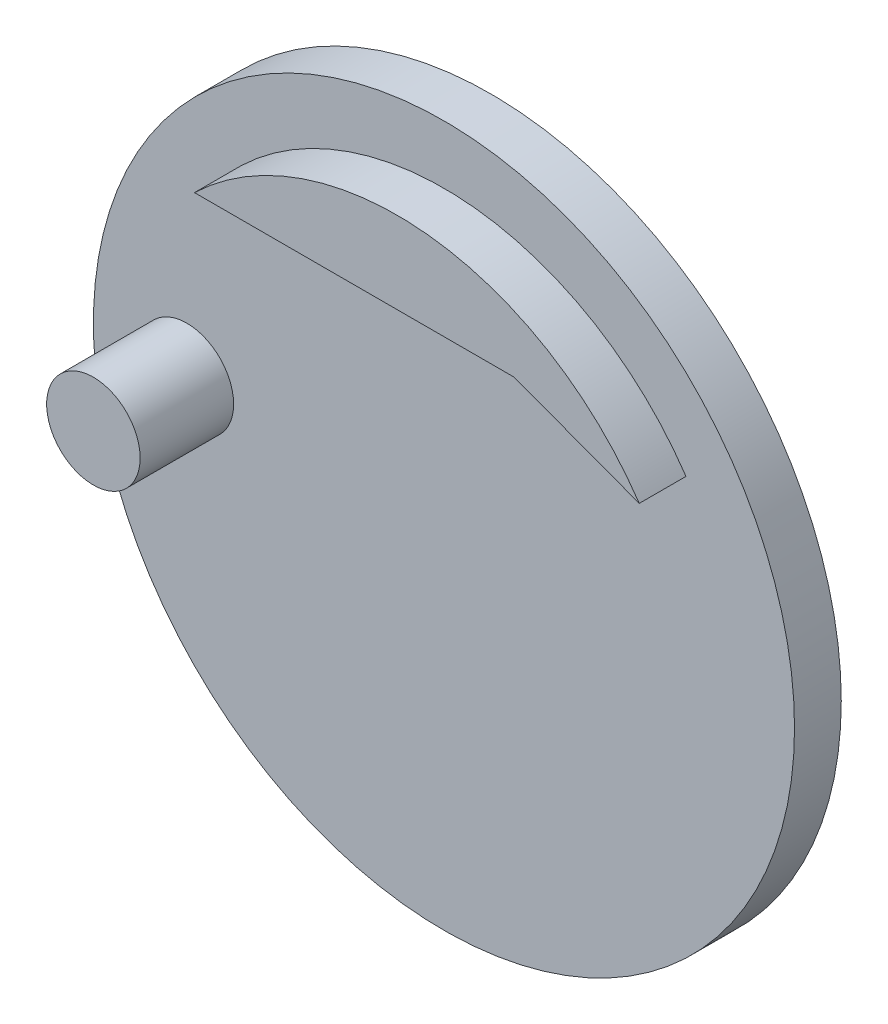
from build123d import *

# Parameters (mm, degrees)
SKETCH1_R           = 37.5
BOSS_EXTRUDE1_DEPTH = 5
BOSS_EXTRUDE2_DEPTH = 5
SKETCH4_R           = 5
BOSS_EXTRUDE3_DEPTH = 10


with BuildPart() as part:
    # Sketch1 → Boss-Extrude1 (new body)
    with BuildSketch(Plane.XY):
        Circle(SKETCH1_R)
    extrude(amount=BOSS_EXTRUDE1_DEPTH)

    # Sketch3 → Boss-Extrude2 (add)
    with BuildSketch(Plane.XY.offset(5)):
        with BuildLine():
            Line((25.890393972, 17.5), (12.5, 22.5))
            Line((12.5, 22.5), (-21.686689466, 22.5))
            ThreePointArc((-21.686689466, 22.5), (3.266157206, 31.078846779), (25.890393972, 17.5))
        make_face()
    extrude(amount=BOSS_EXTRUDE2_DEPTH)

    # Sketch4 → Boss-Extrude3 (add)
    with BuildSketch(Plane.XY.offset(5)):
        with Locations((-27.5, 0)):
            Circle(SKETCH4_R)
    extrude(amount=BOSS_EXTRUDE3_DEPTH)


solid = part.part
